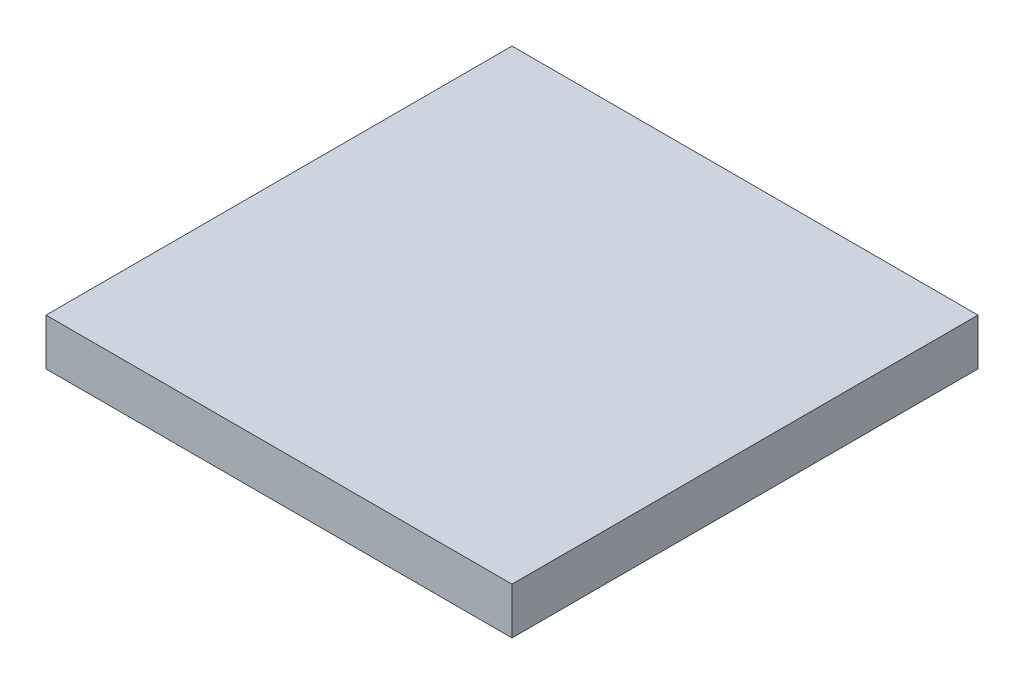
from build123d import *

# Parameters (mm, degrees)
SKETCH1_W           = 10
SKETCH1_H           = 10
BOSS_EXTRUDE1_DEPTH = 1


with BuildPart() as part:
    # Sketch1 → Boss-Extrude1 (new body)
    with BuildSketch(Plane(origin=(0, 0, 0), x_dir=(1, 0, 0), z_dir=(0, 1, 0))):
        Rectangle(SKETCH1_W, SKETCH1_H)
    extrude(amount=BOSS_EXTRUDE1_DEPTH)


solid = part.part
